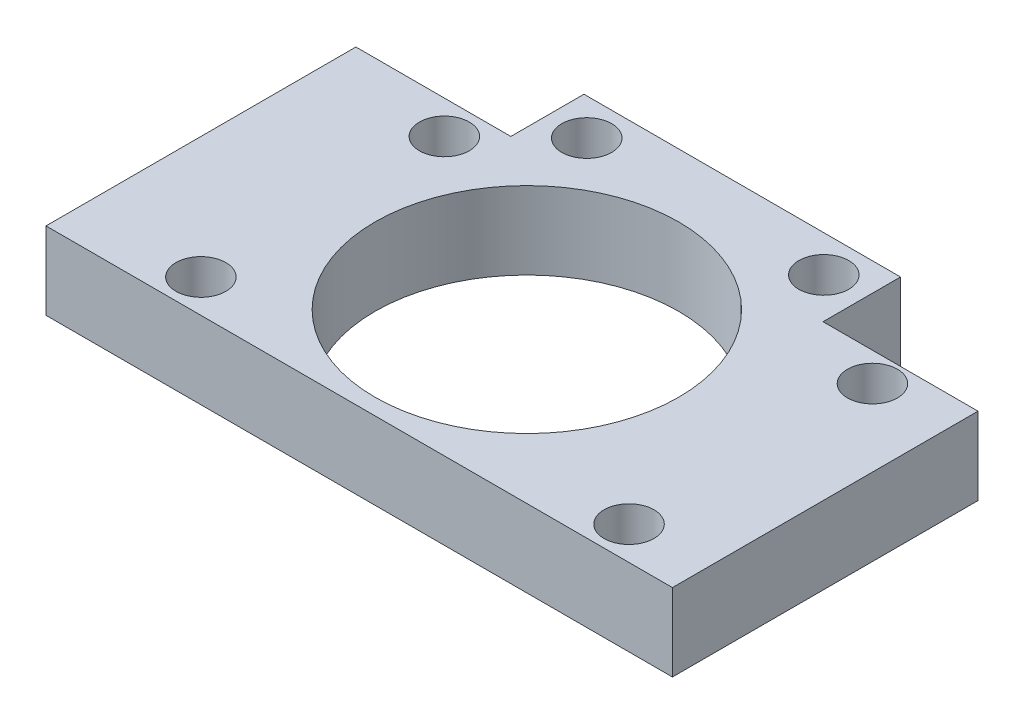
from build123d import *

# Parameters (mm, degrees)
CROQUIS1_R              = 9.8
CROQUIS1_R_2            = 1.61
CROQUIS1_R_3            = 1.610199264
CROQUIS1_R_4            = 1.610298895
SALIENTE_EXTRUIR2_DEPTH = 2.5


with BuildPart() as part:
    # Croquis1 → Saliente-Extruir2 (new, symmetric)
    with BuildSketch(Plane(origin=(0, 0, 0), x_dir=(1, 0, 0), z_dir=(0, 1, 0))):
        Polygon((-20.192989013, 7.194690523), (-10.192989013, 7.194690523), (-10.192989013, 11.914690523), (10.237010987, 11.914690523), (10.237010987, 6.914690523), (20.237010987, 6.914690523), (20.237010987, -12.805309477), (-20.192989013, -12.805309477), align=None)
        with Locations(Location((0, -1.965309477, 0), (0, 0, 270))):
            Circle(CROQUIS1_R, mode=Mode.SUBTRACT)
        with Locations(Location((-12.339891833, 5.049690523, 0), (0, 0, 270))):
            Circle(CROQUIS1_R_2, mode=Mode.SUBTRACT)
        with Locations(Location((-12.339891833, -10.660508741, 0), (0, 0, 270))):
            Circle(CROQUIS1_R_3, mode=Mode.SUBTRACT)
        with Locations(Location((15.290108167, 5.049690523, 0), (0, 0, 270))):
            Circle(CROQUIS1_R_2, mode=Mode.SUBTRACT)
        with Locations(Location((15.290108167, -10.660608373, 0), (0, 0, 270))):
            Circle(CROQUIS1_R_4, mode=Mode.SUBTRACT)
        with Locations(Location((-7.653762012, 9.553535498, 0), (0, 0, 270))):
            Circle(CROQUIS1_R_4, mode=Mode.SUBTRACT)
        with Locations(Location((7.645768396, 9.553535498, 0), (0, 0, 270))):
            Circle(CROQUIS1_R_4, mode=Mode.SUBTRACT)
    extrude(amount=SALIENTE_EXTRUIR2_DEPTH, both=True)


solid = part.part
